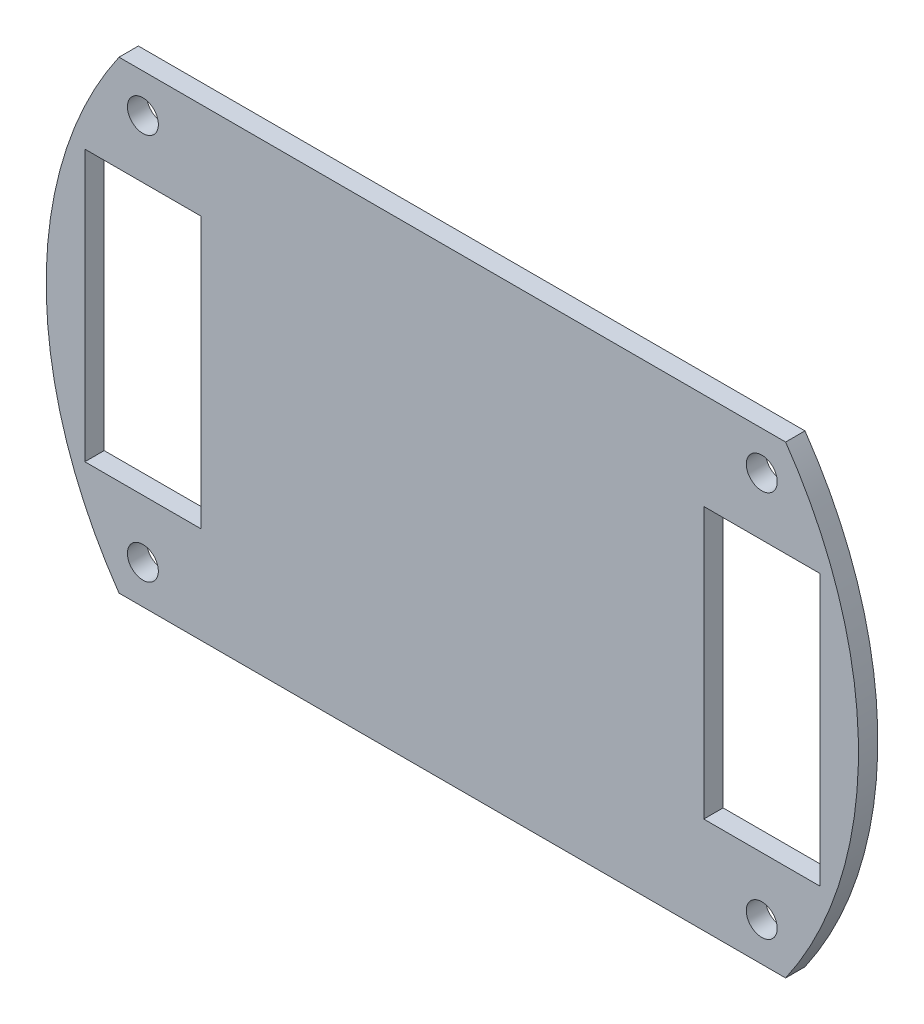
from build123d import *

# Parameters (mm, degrees)
ESQUISSE1_R             = 105
ESQUISSE1_R_2           = 4
ESQUISSE1_W             = 30
ESQUISSE1_H             = 70
BOSS_EXTRU_1_DEPTH      = 5
ESQUISSE2_W             = 250
ESQUISSE2_H             = 50
ENL_V_MAT_EXTRU_1_DEPTH = 149.576579581


with BuildPart() as part:
    # Esquisse1 → Boss.-Extru.1 (new body)
    with BuildSketch(Plane.XY):
        Circle(ESQUISSE1_R)
        with Locations((-80, 50)):
            Circle(ESQUISSE1_R_2, mode=Mode.SUBTRACT)
        with Locations(Location((80, 50, 0), (0, 0, 180))):
            Circle(ESQUISSE1_R_2, mode=Mode.SUBTRACT)
        with Locations((80, -50)):
            Circle(ESQUISSE1_R_2, mode=Mode.SUBTRACT)
        with Locations(Location((-80, -50, 0), (0, 0, 180))):
            Circle(ESQUISSE1_R_2, mode=Mode.SUBTRACT)
        with Locations((-80, 0)):
            Rectangle(ESQUISSE1_W, ESQUISSE1_H, mode=Mode.SUBTRACT)
        with Locations((80, 0)):
            Rectangle(ESQUISSE1_W, ESQUISSE1_H, mode=Mode.SUBTRACT)
    extrude(amount=BOSS_EXTRU_1_DEPTH)

    # Esquisse2 → Enlèv. mat.-Extru.1 (cut, through all)
    with BuildSketch(Plane.XY.offset(5)):
        with Locations((0, 85)):
            Rectangle(ESQUISSE2_W, ESQUISSE2_H)
        with Locations((0, -85)):
            Rectangle(ESQUISSE2_W, ESQUISSE2_H)
    extrude(amount=-ENL_V_MAT_EXTRU_1_DEPTH, mode=Mode.SUBTRACT)


solid = part.part
